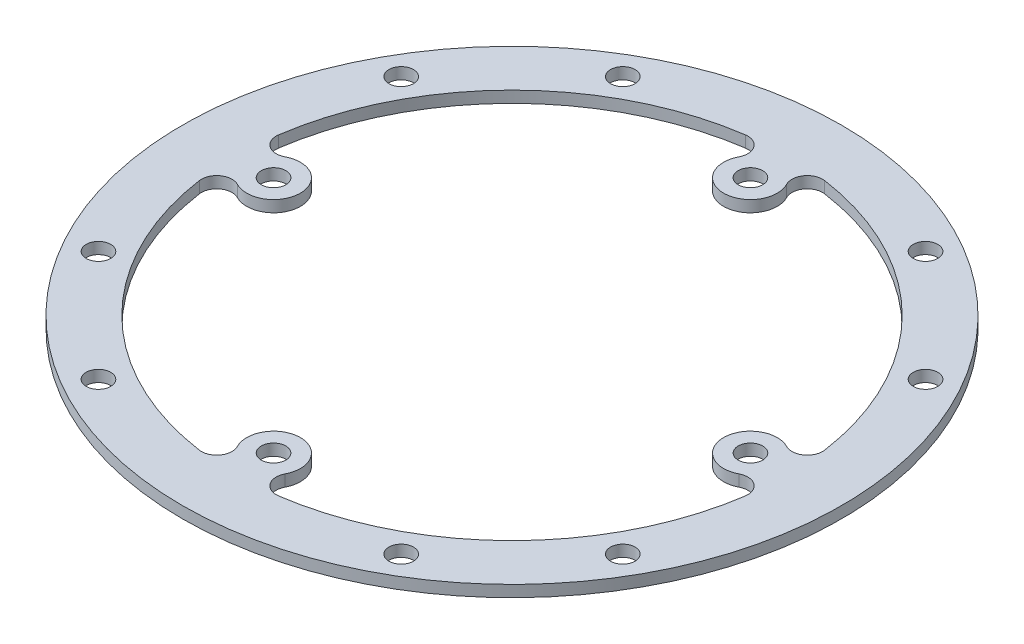
from build123d import *

# Parameters (mm, degrees)
SKETCH1_R                  = 43
BOSS_EXTRUDE1_DEPTH        = 0.75
F_3_2_3_2_DIAMETER_HOLE1_D = 3.2
CUT_EXTRUDE1_DEPTH         = 61.829680256


with BuildPart() as part:
    # Sketch1 → Boss-Extrude1 (new, symmetric)
    with BuildSketch(Plane(origin=(0, 0, 0), x_dir=(1, 0, 0), z_dir=(0, 1, 0))):
        with Locations(Location((0, 0, 0), (0, 0, 270))):
            Circle(SKETCH1_R)
    extrude(amount=BOSS_EXTRUDE1_DEPTH, both=True)

    # Ø3.2 (3.2) Diameter Hole1 (through all)
    with Locations(Plane(origin=(0, 0.75, 0), x_dir=(1, 0, 0), z_dir=(0, 1, 0))):
        with Locations((-34.208003449, 19.75), (-34.208003449, -19.75), (-31.112698372, 0), (19.75, 34.208003449), (-19.75, 34.208003449), (0, 31.112698372), (34.208003449, -19.75), (34.208003449, 19.75), (31.112698372, 0), (-19.75, -34.208003449), (19.75, -34.208003449), (0, -31.112698372), (0, 0)):
            Hole(F_3_2_3_2_DIAMETER_HOLE1_D / 2)

    # Sketch4 → Cut-Extrude1 (cut, through all)
    with BuildSketch(Plane(origin=(0, 0.75, 0), x_dir=(1, 0, 0), z_dir=(0, 1, 0))):
        with BuildLine():
            ThreePointArc((-35.627121412, -5.167999605), (-25.455844123, -25.455844123), (-5.167999605, -35.627121412))
            ThreePointArc((-5.167999605, -35.627121412), (-3.250695933, -34.80648789), (-3.106019964, -32.725968337))
            ThreePointArc((-3.106019964, -32.725968337), (0, -27.612698372), (3.106019964, -32.725968337))
            ThreePointArc((3.106019964, -32.725968337), (3.250695933, -34.80648789), (5.167999605, -35.627121412))
            ThreePointArc((5.167999605, -35.627121412), (25.455844123, -25.455844123), (35.627121412, -5.167999605))
            ThreePointArc((35.627121412, -5.167999605), (34.80648789, -3.250695933), (32.725968337, -3.106019964))
            ThreePointArc((32.725968337, -3.106019964), (27.612698372, 0), (32.725968337, 3.106019964))
            ThreePointArc((32.725968337, 3.106019964), (34.80648789, 3.250695933), (35.627121412, 5.167999605))
            ThreePointArc((35.627121412, 5.167999605), (25.455844123, 25.455844123), (5.167999605, 35.627121412))
            ThreePointArc((5.167999605, 35.627121412), (3.250695933, 34.80648789), (3.106019964, 32.725968337))
            ThreePointArc((3.106019964, 32.725968337), (0, 27.612698372), (-3.106019964, 32.725968337))
            ThreePointArc((-3.106019964, 32.725968337), (-3.250695933, 34.80648789), (-5.167999605, 35.627121412))
            ThreePointArc((-5.167999605, 35.627121412), (-25.455844123, 25.455844123), (-35.627121412, 5.167999605))
            ThreePointArc((-35.627121412, 5.167999605), (-34.80648789, 3.250695933), (-32.725968337, 3.106019964))
            ThreePointArc((-32.725968337, 3.106019964), (-27.612698372, 0), (-32.725968337, -3.106019964))
            ThreePointArc((-32.725968337, -3.106019964), (-34.80648789, -3.250695933), (-35.627121412, -5.167999605))
        make_face()
    extrude(amount=-CUT_EXTRUDE1_DEPTH, mode=Mode.SUBTRACT)


solid = part.part
